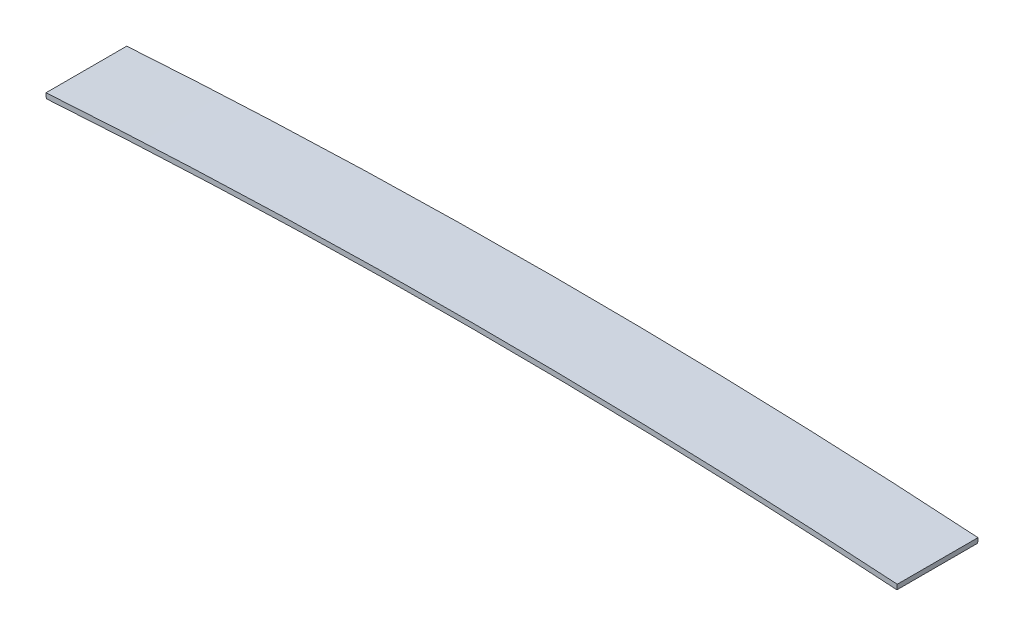
from build123d import *

# Parameters (mm, degrees)
EXTRUDE_1_DEPTH = 8


with BuildPart() as part:
    # Model → Бобышка-Вытянуть1 (new body)
    with BuildSketch(Plane.XY):
        with BuildLine():
            Line((84.297772892, 0), (84.33048595, 0.498928708))
            add(Edge.make_bspline(
                [(84.33048595, 0.498928708), (56.209466291, 2.342728305), (28.088306601, 2.342728305), (-0.032713058, 0.498928708)],
                knots=[0, 0, 0, 0, 1, 1, 1, 1], degree=3))
            Line((-0.032713058, 0.498928708), (0, 0))
            add(Edge.make_bspline(
                [(0, 0), (28.099304307, 1.842375795), (56.198468584, 1.842375795), (84.297772892, 0)],
                knots=[0, 0, 0, 0, 1, 1, 1, 1], degree=3))
        make_face()
    extrude(amount=-EXTRUDE_1_DEPTH)


solid = part.part
